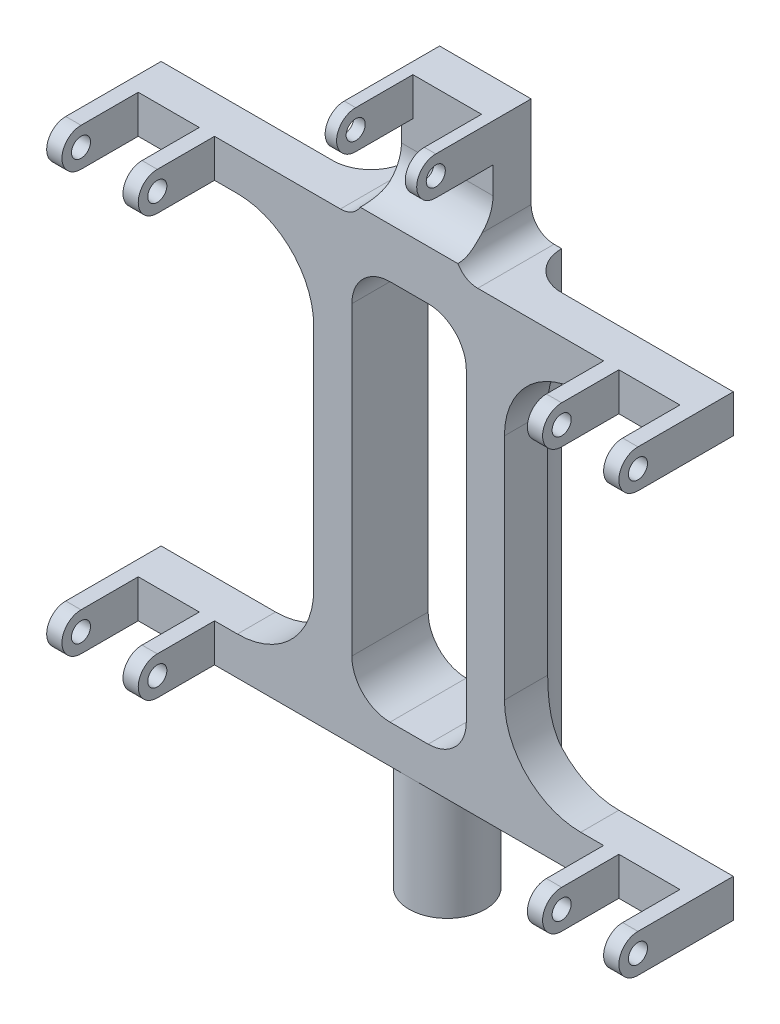
from build123d import *

# Parameters (mm, degrees)
SKETCH1_W               = 150
SKETCH1_H               = 20
BOSS_EXTRUDE1_DEPTH     = 120
SKETCH1_3_R             = 10
BOSS_EXTRUDE2_DEPTH     = 30
SKETCH2_R               = 2.5
BOSS_EXTRUDE3_DEPTH     = 4
LPATTERN1_COUNT         = 2
LPATTERN1_PITCH         = 20
MIRROR1_COPY_1_SKETCH_R = 2.5
MIRROR1_COPY_1_DEPTH    = 4
MIRROR1_COPY_2_SKETCH_R = 2.5
MIRROR1_COPY_2_DEPTH    = 4
MIRROR2_COPY_1_SKETCH_R = 2.5
MIRROR2_COPY_1_DEPTH    = 4
MIRROR2_COPY_2_SKETCH_R = 2.5
MIRROR2_COPY_2_DEPTH    = 4
MIRROR2_COPY_3_SKETCH_R = 2.5
MIRROR2_COPY_3_DEPTH    = 4
MIRROR2_COPY_4_SKETCH_R = 2.5
MIRROR2_COPY_4_DEPTH    = 4
MIRROR2_COPY_5_SKETCH_R = 2.5
MIRROR2_COPY_5_DEPTH    = 4
CUT_EXTRUDE2_DEPTH      = 171.367250374
BOSS_EXTRUDE4_START     = 30
BOSS_EXTRUDE4_DEPTH     = 30
CUT_EXTRUDE1_DEPTH      = 169.893457541
CUT_EXTRUDE3_DEPTH      = 30
CUT_EXTRUDE3_DEPTH_BACK = 30
SKETCH8_R               = 2.5
BOSS_EXTRUDE5_DEPTH     = 3


with BuildPart() as part:
    # Sketch1 → Boss-Extrude1 (new body)
    with BuildSketch(Plane(origin=(0, 0, 0), x_dir=(1, 0, 0), z_dir=(0, 1, 0))):
        Rectangle(SKETCH1_W, SKETCH1_H)
    extrude(amount=BOSS_EXTRUDE1_DEPTH)

    # Sketch1<3> → Boss-Extrude2 (add)
    with BuildSketch(Plane(origin=(0, 0, 0), x_dir=(1, 0, 0), z_dir=(0, 1, 0))):
        Circle(SKETCH1_3_R)
    extrude(amount=-BOSS_EXTRUDE2_DEPTH)

    # Sketch2 → Boss-Extrude3 (add)
    with BuildSketch(Plane.ZY.offset(75)):
        with BuildLine():
            Line((10, 120), (10, 110))
            Line((10, 110), (25, 110))
            ThreePointArc((25, 110), (30, 115), (25, 120))
            Line((25, 120), (10, 120))
        make_face()
        with Locations((25, 115)):
            Circle(SKETCH2_R, mode=Mode.SUBTRACT)
    boss_extrude3 = extrude(amount=-BOSS_EXTRUDE3_DEPTH)

    # LPattern1: Boss-Extrude3 ×2
    with Locations(*[(i * LPATTERN1_PITCH, 0, 0) for i in range(1, LPATTERN1_COUNT)]):
        add(boss_extrude3)

    # Mirror1 copy 1 sketch → Mirror1 copy 1 (add)
    with BuildSketch(Plane(origin=(55, 0, 0), x_dir=(0, 0, 1), z_dir=(1, 0, 0))):
        with BuildLine():
            Line((10, -120), (10, -110))
            Line((10, -110), (25, -110))
            ThreePointArc((25, -110), (30, -115), (25, -120))
            Line((25, -120), (10, -120))
        make_face()
        with Locations((25, -115)):
            Circle(MIRROR1_COPY_1_SKETCH_R, mode=Mode.SUBTRACT)
    extrude(amount=-MIRROR1_COPY_1_DEPTH)

    # Mirror1 copy 2 sketch → Mirror1 copy 2 (add)
    with BuildSketch(Plane(origin=(75, 0, 0), x_dir=(0, 0, 1), z_dir=(1, 0, 0))):
        with BuildLine():
            Line((10, -120), (10, -110))
            Line((10, -110), (25, -110))
            ThreePointArc((25, -110), (30, -115), (25, -120))
            Line((25, -120), (10, -120))
        make_face()
        with Locations((25, -115)):
            Circle(MIRROR1_COPY_2_SKETCH_R, mode=Mode.SUBTRACT)
    extrude(amount=-MIRROR1_COPY_2_DEPTH)

    # Mirror2 copy 1 sketch → Mirror2 copy 1 (add)
    with BuildSketch(Plane(origin=(-55, 120, 0), x_dir=(0, 0, 1), z_dir=(-1, 0, 0))):
        with BuildLine():
            Line((10, -120), (10, -110))
            Line((10, -110), (25, -110))
            ThreePointArc((25, -110), (30, -115), (25, -120))
            Line((25, -120), (10, -120))
        make_face()
        with Locations((25, -115)):
            Circle(MIRROR2_COPY_1_SKETCH_R, mode=Mode.SUBTRACT)
    extrude(amount=-MIRROR2_COPY_1_DEPTH)

    # Mirror2 copy 2 sketch → Mirror2 copy 2 (add)
    with BuildSketch(Plane(origin=(-75, 120, 0), x_dir=(0, 0, 1), z_dir=(-1, 0, 0))):
        with BuildLine():
            Line((10, -120), (10, -110))
            Line((10, -110), (25, -110))
            ThreePointArc((25, -110), (30, -115), (25, -120))
            Line((25, -120), (10, -120))
        make_face()
        with Locations((25, -115)):
            Circle(MIRROR2_COPY_2_SKETCH_R, mode=Mode.SUBTRACT)
    extrude(amount=-MIRROR2_COPY_2_DEPTH)

    # Mirror2 copy 3 sketch → Mirror2 copy 3 (add)
    with BuildSketch(Plane(origin=(55, 120, 0), x_dir=(0, 0, 1), z_dir=(1, 0, 0))):
        with BuildLine():
            Line((10, 120), (10, 110))
            Line((10, 110), (25, 110))
            ThreePointArc((25, 110), (30, 115), (25, 120))
            Line((25, 120), (10, 120))
        make_face()
        with Locations((25, 115)):
            Circle(MIRROR2_COPY_3_SKETCH_R, mode=Mode.SUBTRACT)
    extrude(amount=-MIRROR2_COPY_3_DEPTH)

    # Mirror2 copy 4 sketch → Mirror2 copy 4 (add)
    with BuildSketch(Plane(origin=(75, 120, 0), x_dir=(0, 0, 1), z_dir=(1, 0, 0))):
        with BuildLine():
            Line((10, 120), (10, 110))
            Line((10, 110), (25, 110))
            ThreePointArc((25, 110), (30, 115), (25, 120))
            Line((25, 120), (10, 120))
        make_face()
        with Locations((25, 115)):
            Circle(MIRROR2_COPY_4_SKETCH_R, mode=Mode.SUBTRACT)
    extrude(amount=-MIRROR2_COPY_4_DEPTH)

    # Mirror2 copy 5 sketch → Mirror2 copy 5 (add)
    with BuildSketch(Plane(origin=(-75, 120, 0), x_dir=(0, 0, 1), z_dir=(-1, 0, 0))):
        with BuildLine():
            Line((10, -120), (10, -110))
            Line((10, -110), (25, -110))
            ThreePointArc((25, -110), (30, -115), (25, -120))
            Line((25, -120), (10, -120))
        make_face()
        with Locations((25, -115)):
            Circle(MIRROR2_COPY_5_SKETCH_R, mode=Mode.SUBTRACT)
    extrude(amount=-MIRROR2_COPY_5_DEPTH)

    # Sketch5 → Cut-Extrude2 (cut, through all)
    with BuildSketch(Plane(origin=(0, 120, 0), x_dir=(1, 0, 0), z_dir=(0, 1, 0))):
        with BuildLine():
            Line((-75, 0), (-30, 0))
            ThreePointArc((-30, 0), (-22.928932188, 2.928932188), (-20, 10))
            Line((-20, 10), (-75, 10))
            Line((-75, 10), (-75, 0))
        make_face()
        with BuildLine():
            Line((75, 10), (20, 10))
            ThreePointArc((20, 10), (22.928932188, 2.928932188), (30, 0))
            Line((30, 0), (75, 0))
            Line((75, 0), (75, 10))
        make_face()
    extrude(amount=-CUT_EXTRUDE2_DEPTH, mode=Mode.SUBTRACT)

    # Sketch6 → Boss-Extrude4 (add)
    with BuildSketch(Plane(origin=(0, 120, 0), x_dir=(1, 0, 0), z_dir=(0, 1, 0)).offset(BOSS_EXTRUDE4_START)):
        with BuildLine():
            Line((-30, 0), (-30, -10))
            Line((-30, -10), (30, -10))
            Line((30, -10), (30, 0))
            ThreePointArc((30, 0), (22.928932188, 2.928932188), (20, 10))
            Line((20, 10), (-20, 10))
            ThreePointArc((-20, 10), (-22.928932188, 2.928932188), (-30, 0))
        make_face()
    extrude(amount=-BOSS_EXTRUDE4_DEPTH)

    # Sketch3 → Cut-Extrude1 (cut, through all)
    with BuildSketch(Plane.XY.offset(10)):
        with BuildLine():
            Line((-75, 10), (-45, 10))
            ThreePointArc((-45, 10), (-30.857864376, 15.857864376), (-25, 30))
            Line((-25, 30), (-25, 90))
            ThreePointArc((-25, 90), (-30.857864376, 104.142135624), (-45, 110))
            Line((-45, 110), (-75, 110))
            Line((-75, 110), (-75, 10))
        make_face()
        with BuildLine():
            Line((75, 10), (45, 10))
            ThreePointArc((45, 10), (30.857864376, 15.857864376), (25, 30))
            Line((25, 30), (25, 90))
            ThreePointArc((25, 90), (30.857864376, 104.142135624), (45, 110))
            Line((45, 110), (75, 110))
            Line((75, 110), (75, 10))
        make_face()
        with BuildLine():
            Line((-5, 10), (5, 10))
            ThreePointArc((5, 10), (12.071067812, 12.928932188), (15, 20))
            Line((15, 20), (15, 100))
            ThreePointArc((15, 100), (12.071067812, 107.071067812), (5, 110))
            Line((5, 110), (-5, 110))
            ThreePointArc((-5, 110), (-12.071067812, 107.071067812), (-15, 100))
            Line((-15, 100), (-15, 20))
            ThreePointArc((-15, 20), (-12.071067812, 12.928932188), (-5, 10))
        make_face()
        with BuildLine():
            Line((-30, 120), (-18, 120))
            ThreePointArc((-18, 120), (-13.757359313, 121.757359313), (-12, 126))
            Line((-12, 126), (-12, 150))
            Line((-12, 150), (-30, 150))
            Line((-30, 150), (-30, 120))
        make_face()
        with BuildLine():
            Line((30, 150), (30, 120))
            Line((30, 120), (18, 120))
            ThreePointArc((18, 120), (13.757359313, 121.757359313), (12, 126))
            Line((12, 126), (12, 150))
            Line((12, 150), (30, 150))
        make_face()
    extrude(amount=-CUT_EXTRUDE1_DEPTH, mode=Mode.SUBTRACT)

    # Sketch7 → Cut-Extrude3 (cut, two sides: drawn at the far end of the back side and taken through both)
    with BuildSketch(Plane(origin=(0, 0, 0), x_dir=(0, 0, -1), z_dir=(1, 0, 0)).offset(-CUT_EXTRUDE3_DEPTH_BACK)):
        with BuildLine():
            Line((-10, 150), (0, 150))
            Line((0, 150), (0, 133))
            ThreePointArc((0, 133), (-2.928932188, 125.928932188), (-10, 123))
            Line((-10, 123), (-10, 150))
        make_face()
    extrude(amount=CUT_EXTRUDE3_DEPTH + CUT_EXTRUDE3_DEPTH_BACK, mode=Mode.SUBTRACT)

    # Sketch8 → Boss-Extrude5 (add)
    with BuildSketch(Plane.ZY.offset(12)):
        with BuildLine():
            Line((0, 150), (0, 140))
            Line((0, 140), (15, 140))
            ThreePointArc((15, 140), (20, 145), (15, 150))
            Line((15, 150), (0, 150))
        make_face()
        with Locations((15, 145)):
            Circle(SKETCH8_R, mode=Mode.SUBTRACT)
    boss_extrude5 = extrude(amount=-BOSS_EXTRUDE5_DEPTH)

    # Mirror5: Boss-Extrude5 across plane
    add(boss_extrude5.mirror(Plane(origin=(0, 0, 0), x_dir=(0, 0, 1), z_dir=(1, 0, 0))))


solid = part.part
